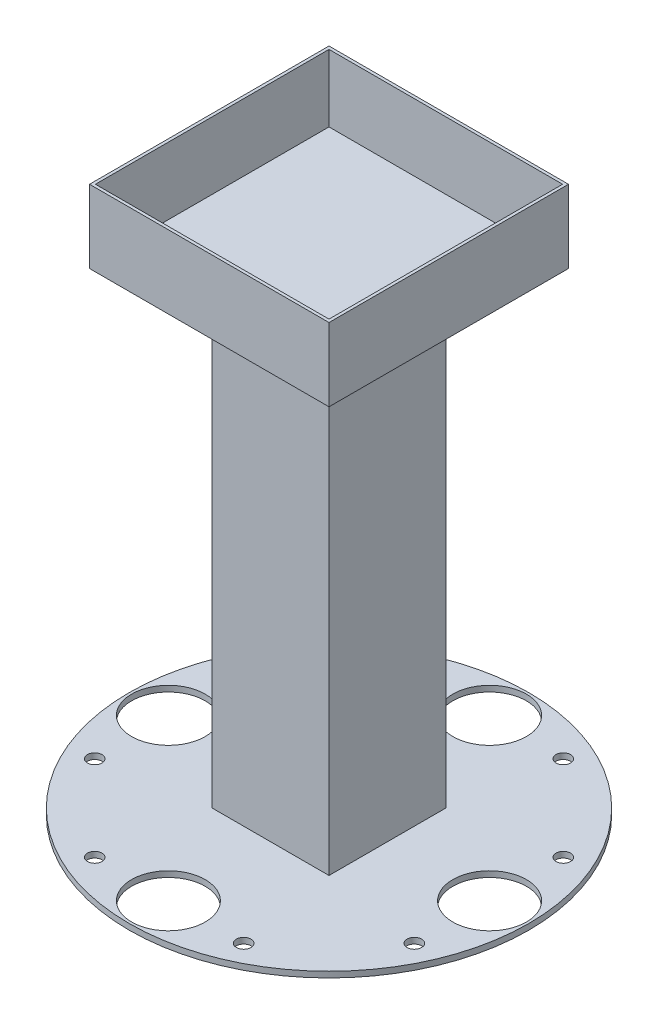
from build123d import *

# Parameters (mm, degrees)
SKETCH1_R           = 86.9315
BOSS_EXTRUDE1_DEPTH = 2.54
SKETCH2_W           = 50.8
SKETCH2_H           = 50.8
BOSS_EXTRUDE2_DEPTH = 203.2
SKETCH3_R           = 3.175
CUT_EXTRUDE1_DEPTH  = 203.2
SKETCH4_W           = 104.14
SKETCH4_H           = 104.14
BOSS_EXTRUDE3_DEPTH = 31.75
SKETCH5_W           = 101.6
SKETCH5_H           = 101.6
CUT_EXTRUDE2_DEPTH  = 29.21
SKETCH9_R           = 16.002
CUT_EXTRUDE3_DEPTH  = 266.171027611
CIRPATTERN1_COUNT   = 4


with BuildPart() as part:
    # Sketch1 → Boss-Extrude1 (new body)
    with BuildSketch(Plane(origin=(0, 0, 0), x_dir=(1, 0, 0), z_dir=(0, 1, 0))):
        with Locations(Location((0, 0, 0), (0, 0, 270))):
            Circle(SKETCH1_R)
    extrude(amount=BOSS_EXTRUDE1_DEPTH)

    # Sketch2 → Boss-Extrude2 (add)
    with BuildSketch(Plane(origin=(0, 2.54, 0), x_dir=(1, 0, 0), z_dir=(0, 1, 0))):
        Rectangle(SKETCH2_W, SKETCH2_H)
    extrude(amount=BOSS_EXTRUDE2_DEPTH)

    # Sketch3 → Cut-Extrude1 (cut)
    with BuildSketch(Plane(origin=(0, 2.54, 0), x_dir=(1, 0, 0), z_dir=(0, 1, 0))):
        with Locations(Location((-32.385, 69.50075, 0), (0, 0, 270))):
            Circle(SKETCH3_R)
        with Locations(Location((32.385, 69.50075, 0), (0, 0, 270))):
            Circle(SKETCH3_R)
        with Locations(Location((69.50075, 32.385, 0), (0, 0, 270))):
            Circle(SKETCH3_R)
        with Locations(Location((69.50075, -32.385, 0), (0, 0, 270))):
            Circle(SKETCH3_R)
        with Locations(Location((32.385, -69.50075, 0), (0, 0, 270))):
            Circle(SKETCH3_R)
        with Locations(Location((-32.385, -69.50075, 0), (0, 0, 270))):
            Circle(SKETCH3_R)
        with Locations(Location((-69.50075, -32.385, 0), (0, 0, 270))):
            Circle(SKETCH3_R)
        with Locations(Location((-69.50075, 32.385, 0), (0, 0, 270))):
            Circle(SKETCH3_R)
    extrude(amount=-CUT_EXTRUDE1_DEPTH, mode=Mode.SUBTRACT)

    # Sketch4 → Boss-Extrude3 (add)
    with BuildSketch(Plane(origin=(0, 205.74, 0), x_dir=(1, 0, 0), z_dir=(0, 1, 0))):
        Rectangle(SKETCH4_W, SKETCH4_H)
    extrude(amount=BOSS_EXTRUDE3_DEPTH)

    # Sketch5 → Cut-Extrude2 (cut)
    with BuildSketch(Plane(origin=(0, 237.49, 0), x_dir=(1, 0, 0), z_dir=(0, 1, 0))):
        Rectangle(SKETCH5_W, SKETCH5_H)
    extrude(amount=-CUT_EXTRUDE2_DEPTH, mode=Mode.SUBTRACT)

    # Sketch9 → Cut-Extrude3 (cut, through all)
    with BuildSketch(Plane(origin=(0, 2.54, 0), x_dir=(1, 0, 0), z_dir=(0, 1, 0))):
        with Locations(Location((69.85, 0, 0), (0, 0, 270))):
            Circle(SKETCH9_R)
    cut_extrude3 = extrude(amount=-CUT_EXTRUDE3_DEPTH, mode=Mode.SUBTRACT)

    # CirPattern1: Cut-Extrude3 ×4 about axis
    cirpattern1_axis = Axis((0, 0, 0), (0, 1, 0))
    for i in range(1, CIRPATTERN1_COUNT):
        add(cut_extrude3.rotate(cirpattern1_axis, i * 360 / CIRPATTERN1_COUNT), mode=Mode.SUBTRACT)


solid = part.part
